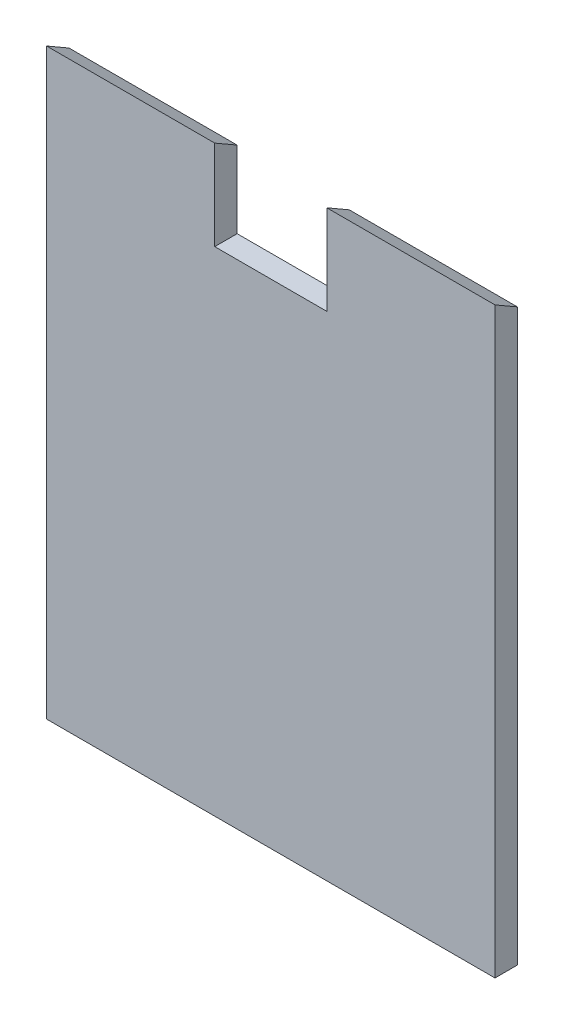
from build123d import *

# Parameters (mm, degrees)
BOSS_EXTRUDE1_DEPTH = 6.35
CUT_EXTRUDE1_DEPTH  = 127


with BuildPart() as part:
    # Sketch1 → Boss-Extrude1 (new, symmetric)
    with BuildSketch(Plane.XY):
        Polygon((127, -165.1), (-127, -165.1), (-127, 165.1), (-31.75, 165.1), (-31.75, 114.3), (31.75, 114.3), (31.75, 165.1), (127, 165.1), align=None)
    extrude(amount=BOSS_EXTRUDE1_DEPTH, both=True)

    # Sketch2 → Cut-Extrude1 (cut, symmetric)
    with BuildSketch(Plane(origin=(0, 0, 0), x_dir=(0, 0, -1), z_dir=(1, 0, 0))):
        Polygon((-6.35, 165.1), (6.35, 165.1), (6.35, 157.767651581), align=None)
    extrude(amount=CUT_EXTRUDE1_DEPTH, both=True, mode=Mode.SUBTRACT)


solid = part.part
